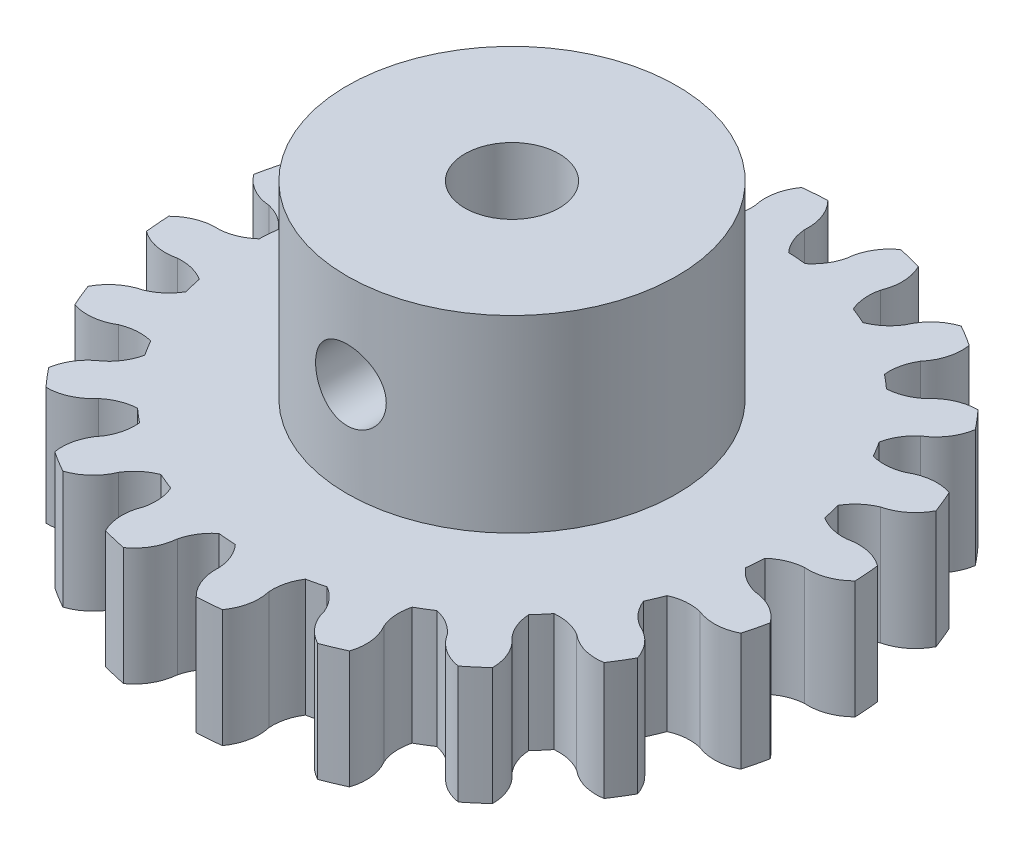
from build123d import *

# Parameters (mm, degrees)
SKETCH1_R               = 14
BOSS_EXTRUDE2_DEPTH     = 6
CUT_EXTRUDE4_DEPTH      = 14
CIRPATTERN2_COUNT       = 20
SKETCH6_R               = 2
CUT_EXTRUDE5_DEPTH      = 14
SKETCH7_R               = 19.184099912
CUT_EXTRUDE6_DEPTH      = 1
BOSS_EXTRUDE3_START     = 8
SKETCH8_R               = 7
SKETCH8_R_2             = 2
BOSS_EXTRUDE3_DEPTH     = 8
CUT_EXTRUDE7_DEPTH      = 16
CUT_EXTRUDE7_DEPTH_BACK = 15
SKETCH9_R               = 1.5


with BuildPart() as part:
    # Sketch1 → Boss-Extrude2 (new body)
    with BuildSketch(Plane(origin=(0, 0, 0), x_dir=(1, 0, 0), z_dir=(0, 1, 0))):
        Circle(SKETCH1_R)
    extrude(amount=BOSS_EXTRUDE2_DEPTH)

    # Sketch1<3> → Cut-Extrude4 (cut)
    with BuildSketch(Plane(origin=(0, 0, 0), x_dir=(1, 0, 0), z_dir=(0, 1, 0))):
        with BuildLine():
            ThreePointArc((2.764145838, 13.724412475), (1.099764336, 13.956737384), (-0.580463539, 13.987961327))
            ThreePointArc((-0.580463539, 13.987961327), (-0.117613655, 13.265603704), (0, 12.415781618))
            ThreePointArc((0, 12.415781618), (0.155194047, 11.785835551), (0.503865395, 11.238710765))
            ThreePointArc((0.503865395, 11.238710765), (0.883739199, 11.215235398), (1.262601532, 11.178923802))
            ThreePointArc((1.262601532, 11.178923802), (1.692662406, 11.664685971), (1.944605583, 12.2625504))
            ThreePointArc((1.944605583, 12.2625504), (2.193869966, 13.083463195), (2.764145838, 13.724412475))
        make_face()
    cut_extrude4 = extrude(amount=CUT_EXTRUDE4_DEPTH, mode=Mode.SUBTRACT)

    # CirPattern2: Cut-Extrude4 ×20 about axis
    cirpattern2_axis = Axis((0, 6, 0), (0, 1, 0))
    for i in range(1, CIRPATTERN2_COUNT):
        add(cut_extrude4.rotate(cirpattern2_axis, i * 360 / CIRPATTERN2_COUNT), mode=Mode.SUBTRACT)

    # Sketch6 → Cut-Extrude5 (cut)
    with BuildSketch(Plane(origin=(0, 6, 0), x_dir=(1, 0, 0), z_dir=(0, 1, 0))):
        Circle(SKETCH6_R)
    extrude(amount=-CUT_EXTRUDE5_DEPTH, mode=Mode.SUBTRACT)

    # Sketch7 → Cut-Extrude6 (cut)
    with BuildSketch(Plane(origin=(0, 0, 0), x_dir=(-1, 0, 0), z_dir=(0, -1, 0))):
        Circle(SKETCH7_R)
    extrude(amount=-CUT_EXTRUDE6_DEPTH, mode=Mode.SUBTRACT)

    # Sketch8 → Boss-Extrude3 (add)
    with BuildSketch(Plane(origin=(0, 6, 0), x_dir=(1, 0, 0), z_dir=(0, 1, 0)).offset(BOSS_EXTRUDE3_START)):
        Circle(SKETCH8_R)
        Circle(SKETCH8_R_2, mode=Mode.SUBTRACT)
    extrude(amount=-BOSS_EXTRUDE3_DEPTH)

    # Sketch9 → Cut-Extrude7 (cut, two sides: drawn at the far end of the back side and taken through both)
    with BuildSketch(Plane.XY.offset(-CUT_EXTRUDE7_DEPTH_BACK)):
        with Locations((0, 10)):
            Circle(SKETCH9_R)
    extrude(amount=CUT_EXTRUDE7_DEPTH + CUT_EXTRUDE7_DEPTH_BACK, mode=Mode.SUBTRACT)


solid = part.part
